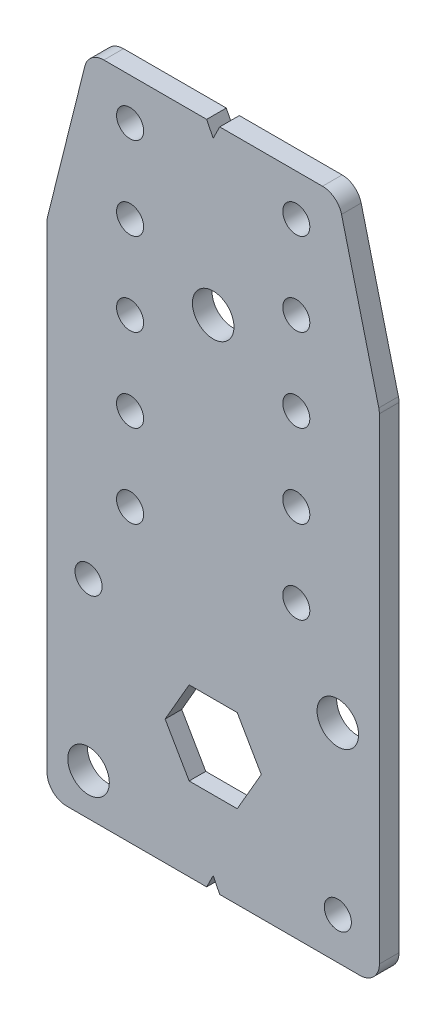
from build123d import *

# Parameters (mm, degrees)
SKETCH1_R           = 12.7
SKETCH1_R_2         = 3.175
SKETCH1_R_3         = 2.07
BOSS_EXTRUDE1_DEPTH = 1.5
FILLET1_R           = 3.000000096
CUT_EXTRUDE1_START  = -3
CUT_EXTRUDE1_DEPTH  = 3
BOSS_EXTRUDE3_START = -2.54
BOSS_EXTRUDE3_DEPTH = 2.54


with BuildPart() as part:
    # Sketch1 → Boss-Extrude1 (new, symmetric)
    with BuildSketch(Plane.XY):
        Polygon((-19.05, 82.55), (19.05, 82.55), (25.4, 57.15), (25.4, -19.05), (-25.4, -19.05), (-25.4, 57.15), align=None)
        Circle(SKETCH1_R, mode=Mode.SUBTRACT)
        with Locations((-19.05, -12.7)):
            Circle(SKETCH1_R_2, mode=Mode.SUBTRACT)
        with Locations((19.05, 12.7)):
            Circle(SKETCH1_R_2, mode=Mode.SUBTRACT)
        with Locations((-19.05, 12.7)):
            Circle(SKETCH1_R_3, mode=Mode.SUBTRACT)
        with Locations((19.05, -12.7)):
            Circle(SKETCH1_R_3, mode=Mode.SUBTRACT)
        with Locations((0, 57.15)):
            Circle(SKETCH1_R_2, mode=Mode.SUBTRACT)
        with Locations((12.7, 25.4)):
            Circle(SKETCH1_R_3, mode=Mode.SUBTRACT)
        with Locations((12.7, 38.1)):
            Circle(SKETCH1_R_3, mode=Mode.SUBTRACT)
        with Locations((12.7, 50.8)):
            Circle(SKETCH1_R_3, mode=Mode.SUBTRACT)
        with Locations((12.7, 63.5)):
            Circle(SKETCH1_R_3, mode=Mode.SUBTRACT)
        with Locations((12.7, 76.2)):
            Circle(SKETCH1_R_3, mode=Mode.SUBTRACT)
        with Locations(Location((-12.7, 25.4, 0), (0, 0, 180))):
            Circle(SKETCH1_R_3, mode=Mode.SUBTRACT)
        with Locations(Location((-12.7, 38.1, 0), (0, 0, 180))):
            Circle(SKETCH1_R_3, mode=Mode.SUBTRACT)
        with Locations(Location((-12.7, 50.8, 0), (0, 0, 180))):
            Circle(SKETCH1_R_3, mode=Mode.SUBTRACT)
        with Locations(Location((-12.7, 63.5, 0), (0, 0, 180))):
            Circle(SKETCH1_R_3, mode=Mode.SUBTRACT)
        with Locations(Location((-12.7, 76.2, 0), (0, 0, 180))):
            Circle(SKETCH1_R_3, mode=Mode.SUBTRACT)
    extrude(amount=BOSS_EXTRUDE1_DEPTH, both=True)

    # Fillet1
    fillet1_edges = [part.edges().sort_by_distance(p)[0] for p in [
        (-19.05, 82.55, 0),
        (19.05, 82.55, 0),
        (25.4, 57.15, 0),
        (25.4, -19.05, 0),
        (-25.4, -19.05, 0),
        (-25.4, 57.15, 0),
    ]]
    fillet(fillet1_edges, radius=FILLET1_R)

    # Sketch2 → Cut-Extrude1 (cut)
    with BuildSketch(Plane.XY.offset(1.5).offset(CUT_EXTRUDE1_START)):
        with BuildLine():
            Line((5.08, 17.78), (-5.08, 17.78))
            Line((-5.08, 17.78), (-5.08, 11.639742265))
            ThreePointArc((-5.08, 11.639742265), (0, 12.7), (5.08, 11.639742265))
            Line((5.08, 11.639742265), (5.08, 17.78))
        make_face()
        Polygon((0, -17.05), (-1, -19.05), (1, -19.05), align=None)
        Polygon((1, 82.55), (-1, 82.55), (0, 80.55), align=None)
    extrude(amount=CUT_EXTRUDE1_DEPTH, mode=Mode.SUBTRACT)

    # Sketch3 → Boss-Extrude3 (add)
    with BuildSketch(Plane.XY.offset(1.5).offset(BOSS_EXTRUDE3_START)):
        with BuildLine():
            Line((5.08, 17.78), (5.08, 11.639742265))
            ThreePointArc((5.08, 11.639742265), (0, -12.7), (-5.08, 11.639742265))
            Line((-5.08, 11.639742265), (-5.08, 17.78))
            Line((-5.08, 17.78), (5.08, 17.78))
        make_face()
        Polygon((7.347013116, 0), (3.673506558, 6.3627), (-3.673506558, 6.3627), (-7.347013116, 0), (-3.673506558, -6.3627), (3.673506558, -6.3627), align=None, mode=Mode.SUBTRACT)
    extrude(amount=BOSS_EXTRUDE3_DEPTH)


solid = part.part
